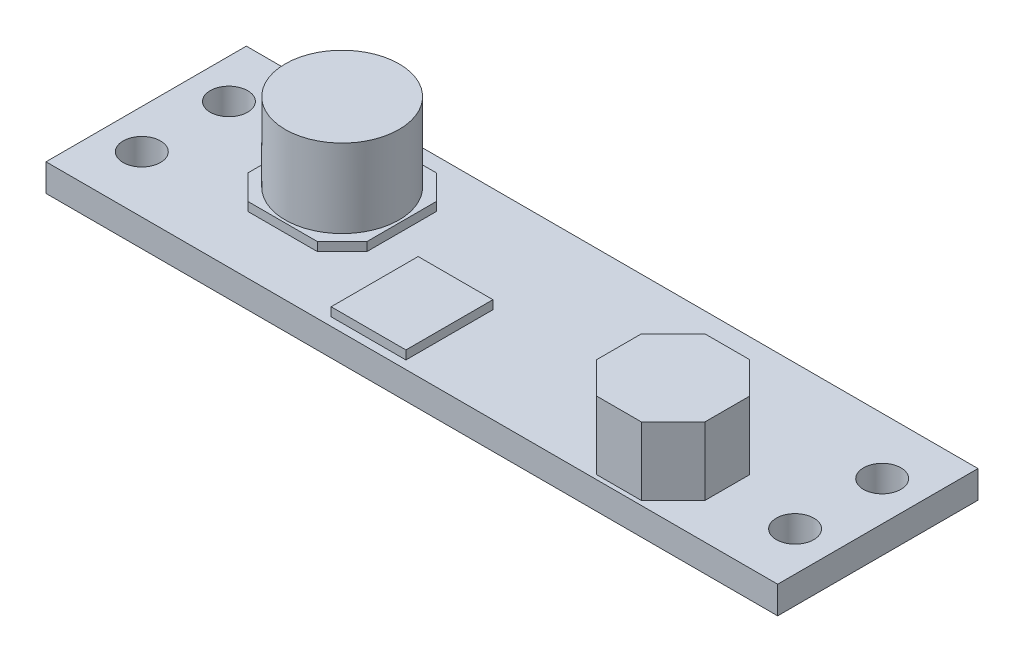
from build123d import *

# Parameters (mm, degrees)
SKETCH1_W           = 42.672
SKETCH1_H           = 11.684
SKETCH1_R           = 1.0922
BOSS_EXTRUDE1_DEPTH = 1.6002
SKETCH2_W           = 4.360829253
SKETCH2_H           = 5.074241287
BOSS_EXTRUDE2_DEPTH = 0.508
BOSS_EXTRUDE3_DEPTH = 0.508
SKETCH4_R           = 3.318325067
BOSS_EXTRUDE4_DEPTH = 4.572
BOSS_EXTRUDE5_DEPTH = 3.96875


with BuildPart() as part:
    # Sketch1 → Boss-Extrude1 (new body)
    with BuildSketch(Plane(origin=(0, 0, 0), x_dir=(1, 0, 0), z_dir=(0, 1, 0))):
        Rectangle(SKETCH1_W, SKETCH1_H)
        with Locations(Location((-19.05, 2.54, 0), (0, 0, 270))):
            Circle(SKETCH1_R, mode=Mode.SUBTRACT)
        with Locations(Location((-19.05, -2.54, 0), (0, 0, 270))):
            Circle(SKETCH1_R, mode=Mode.SUBTRACT)
        with Locations(Location((19.05, 2.54, 0), (0, 0, 270))):
            Circle(SKETCH1_R, mode=Mode.SUBTRACT)
        with Locations(Location((19.05, -2.54, 0), (0, 0, 270))):
            Circle(SKETCH1_R, mode=Mode.SUBTRACT)
    extrude(amount=BOSS_EXTRUDE1_DEPTH)

    # Sketch2 → Boss-Extrude2 (add)
    with BuildSketch(Plane(origin=(0, 1.6002, 0), x_dir=(1, 0, 0), z_dir=(0, 1, 0))):
        with Locations((-3.010313867, -2.820245611)):
            Rectangle(SKETCH2_W, SKETCH2_H)
    extrude(amount=BOSS_EXTRUDE2_DEPTH)

    # Sketch3 → Boss-Extrude3 (add)
    with BuildSketch(Plane(origin=(0, 1.6002, 0), x_dir=(1, 0, 0), z_dir=(0, 1, 0))):
        Polygon((-7.440948477, -1.028779312), (-7.440948477, 3.035220688), (-8.877789457, 4.472061667), (-12.941789457, 4.472061667), (-14.378630436, 3.035220688), (-14.378630436, -1.028779312), (-12.941789457, -2.465620292), (-8.877789457, -2.465620292), align=None)
    extrude(amount=BOSS_EXTRUDE3_DEPTH)

    # Sketch4 → Boss-Extrude4 (add)
    with BuildSketch(Plane(origin=(0, 2.1082, 0), x_dir=(1, 0, 0), z_dir=(0, 1, 0))):
        with Locations(Location((-10.909789457, 1.003220688, 0), (0, 0, 90))):
            Circle(SKETCH4_R)
    extrude(amount=BOSS_EXTRUDE4_DEPTH)

    # Sketch5 → Boss-Extrude5 (add)
    with BuildSketch(Plane(origin=(0, 1.6002, 0), x_dir=(1, 0, 0), z_dir=(0, 1, 0))):
        Polygon((14.986, -3.741894505), (14.986, -1.131751289), (13.140350032, 0.71389868), (10.530206815, 0.71389868), (8.684556847, -1.131751289), (8.684556847, -3.741894505), (10.530206815, -5.587544473), (13.140350032, -5.587544473), align=None)
    extrude(amount=BOSS_EXTRUDE5_DEPTH)


solid = part.part
